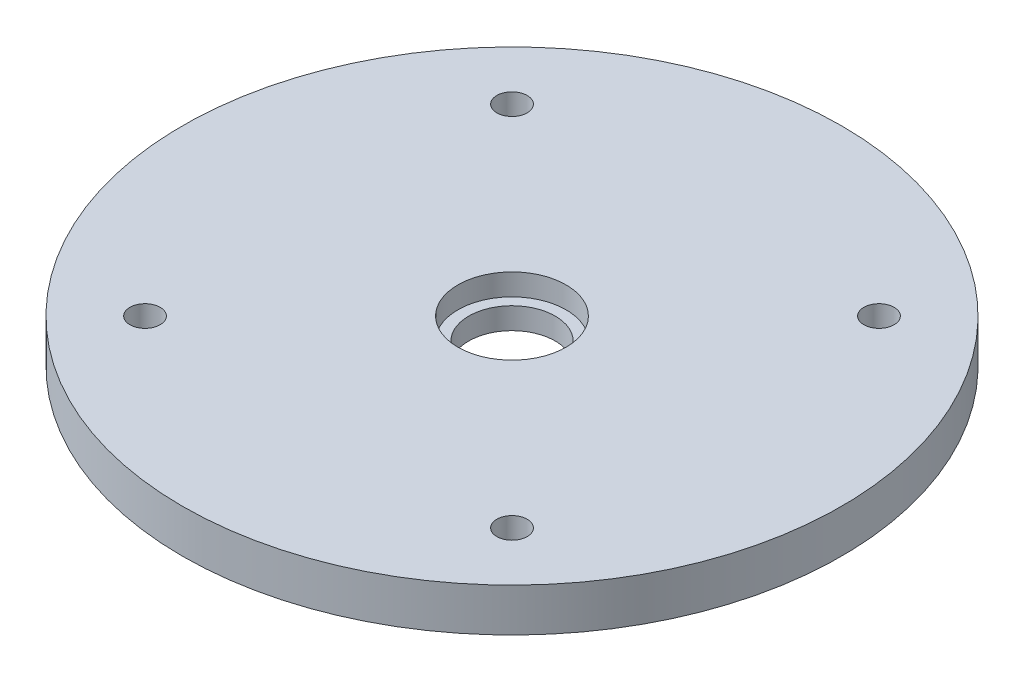
from build123d import *

# Parameters (mm, degrees)
SKETCH1_R           = 38.1
BOSS_EXTRUDE1_DEPTH = 5
SKETCH5_R           = 1.75
CUT_EXTRUDE5_DEPTH  = 3
SKETCH6_R           = 2.5
CUT_EXTRUDE6_DEPTH  = 3
SKETCH7_R           = 6.25
CUT_EXTRUDE7_DEPTH  = 2.5
SKETCH8_R           = 5
CUT_EXTRUDE10_DEPTH = 55.113029854


with BuildPart() as part:
    # Sketch1 → Boss-Extrude1 (new body)
    with BuildSketch(Plane(origin=(0, 0, 0), x_dir=(1, 0, 0), z_dir=(0, 1, 0))):
        with Locations(Location((0, 0, 0), (0, 0, 270))):
            Circle(SKETCH1_R)
    extrude(amount=BOSS_EXTRUDE1_DEPTH)

    # Sketch5 → Cut-Extrude5 (cut)
    with BuildSketch(Plane(origin=(0, 5, 0), x_dir=(1, 0, 0), z_dir=(0, 1, 0))):
        with Locations(Location((21.213203436, 21.213203436, 0), (0, 0, 270))):
            Circle(SKETCH5_R)
        with Locations(Location((-21.213203436, 21.213203436, 0), (0, 0, 270))):
            Circle(SKETCH5_R)
        with Locations(Location((-21.213203436, -21.213203436, 0), (0, 0, 270))):
            Circle(SKETCH5_R)
        with Locations(Location((21.213203436, -21.213203436, 0), (0, 0, 270))):
            Circle(SKETCH5_R)
    extrude(amount=-CUT_EXTRUDE5_DEPTH, mode=Mode.SUBTRACT)

    # Sketch6 → Cut-Extrude6 (cut)
    with BuildSketch(Plane.XZ):
        with Locations(Location((0, -33.1, 0), (0, 0, 270))):
            Circle(SKETCH6_R)
        with Locations(Location((33.1, 0, 0), (0, 0, 270))):
            Circle(SKETCH6_R)
        with Locations(Location((0, 33.1, 0), (0, 0, 270))):
            Circle(SKETCH6_R)
        with Locations(Location((-33.1, 0, 0), (0, 0, 270))):
            Circle(SKETCH6_R)
    extrude(amount=-CUT_EXTRUDE6_DEPTH, mode=Mode.SUBTRACT)

    # Sketch7 → Cut-Extrude7 (cut)
    with BuildSketch(Plane(origin=(0, 5, 0), x_dir=(1, 0, 0), z_dir=(0, 1, 0))):
        with Locations(Location((0, 0, 0), (0, 0, 270))):
            Circle(SKETCH7_R)
    extrude(amount=-CUT_EXTRUDE7_DEPTH, mode=Mode.SUBTRACT)

    # Sketch8 → Cut-Extrude10 (cut, through all)
    with BuildSketch(Plane(origin=(0, 5, 0), x_dir=(1, 0, 0), z_dir=(0, 1, 0))):
        with Locations(Location((0, 0, 0), (0, 0, 270))):
            Circle(SKETCH8_R)
    extrude(amount=-CUT_EXTRUDE10_DEPTH, mode=Mode.SUBTRACT)


solid = part.part
